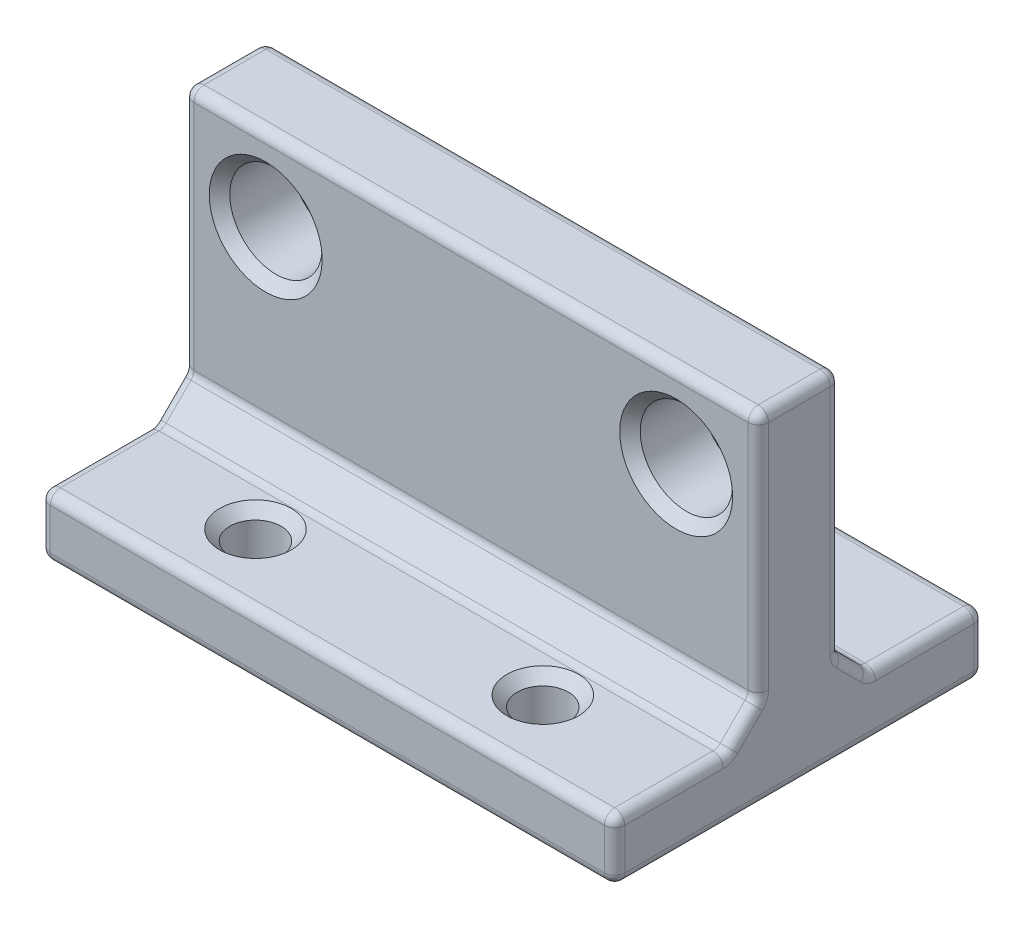
from build123d import *

# Parameters (mm, degrees)
SKETCH_2_W          = 28
SKETCH_2_H          = 15
SKETCH_2_R          = 2.25
EXTRUDE_1_DEPTH     = 2
SKETCH_3_W          = 28
SKETCH_3_H          = 18
EXTRUDE_2_DEPTH     = 1.5
CHAMFER_1_SIZE      = 1.5
SKETCH_1_R          = 1.25
CUT_EXTRUDE_1_DEPTH = 109
FILLET_1_R          = 0.5
CHAMFER_2_SIZE      = 0.5


with BuildPart() as part:
    # 草图2 → 凸台-拉伸1 (new, symmetric)
    with BuildSketch(Plane.XY):
        Rectangle(SKETCH_2_W, SKETCH_2_H)
        with Locations((-10, 3.5)):
            Circle(SKETCH_2_R, mode=Mode.SUBTRACT)
        with Locations((10, 3.5)):
            Circle(SKETCH_2_R, mode=Mode.SUBTRACT)
    extrude(amount=EXTRUDE_1_DEPTH, both=True)

    # 草图3 → 凸台-拉伸2 (add, symmetric)
    with BuildSketch(Plane.XZ.offset(7.5)):
        Rectangle(SKETCH_3_W, SKETCH_3_H)
    extrude(amount=EXTRUDE_2_DEPTH, both=True)

    # 倒角1
    chamfer_1_edges = [part.edges().sort_by_distance(p)[0] for p in [
        (0, -6, 2),
        (0, -6, -2),
    ]]
    chamfer(chamfer_1_edges, length=CHAMFER_1_SIZE)

    # 草图1 → 切除-拉伸1 (cut)
    with BuildSketch(Plane(origin=(0, 0, 0), x_dir=(1, 0, 0), z_dir=(0, 1, 0))):
        with Locations(Location((-7, 5.5, 0), (0, 0, 270))):
            Circle(SKETCH_1_R)
        with Locations(Location((-7, -5.5, 0), (0, 0, 270))):
            Circle(SKETCH_1_R)
        with Locations(Location((7, -5.5, 0), (0, 0, 270))):
            Circle(SKETCH_1_R)
        with Locations(Location((7, 5.5, 0), (0, 0, 270))):
            Circle(SKETCH_1_R)
    extrude(amount=-CUT_EXTRUDE_1_DEPTH, mode=Mode.SUBTRACT)

    # 圆角1
    fillet_1_edges = [part.edges().sort_by_distance(p)[0] for p in [
        (-14, 1.5, 2),
        (14, -7.5, -9),
        (14, -6, -6.25),
        (-14, -6, 6.25),
        (-14, -7.5, 9),
        (0, -6, 9),
        (14, -7.5, 9),
        (0, -6, -9),
        (-14, -7.5, -9),
        (14, -9, 0),
        (0, -9, 9),
        (-14, -9, 0),
        (0, -9, -9),
        (-14, -6, -6.25),
        (0, -6, -3.5),
        (14, 1.5, -2),
        (0, -4.5, -2),
        (14, 1.5, 2),
        (0, -4.5, 2),
        (14, -6, 6.25),
        (0, -6, 3.5),
        (14, -5.25, -2.75),
        (-14, -5.25, -2.75),
        (14, -5.25, 2.75),
        (-14, -5.25, 2.75),
        (-14, 1.5, -2),
        (0, 7.5, -2),
        (-14, 7.5, 0),
        (14, 7.5, 0),
        (0, 7.5, 2),
    ]]
    fillet(fillet_1_edges, radius=FILLET_1_R)

    # 倒角2
    chamfer_2_edges = [part.edges().sort_by_distance(p)[0] for p in [
        (-12.25, 3.5, -2),
        (-12.25, 3.5, 2),
        (7.75, 3.5, -2),
        (7.75, 3.5, 2),
        (7, -9, -6.75),
        (7, -6, -6.75),
        (7, -6, 4.25),
        (7, -9, 4.25),
        (-7, -6, 4.25),
        (-7, -9, 4.25),
        (-7, -9, -6.75),
        (-7, -6, -6.75),
    ]]
    chamfer(chamfer_2_edges, length=CHAMFER_2_SIZE)


solid = part.part
